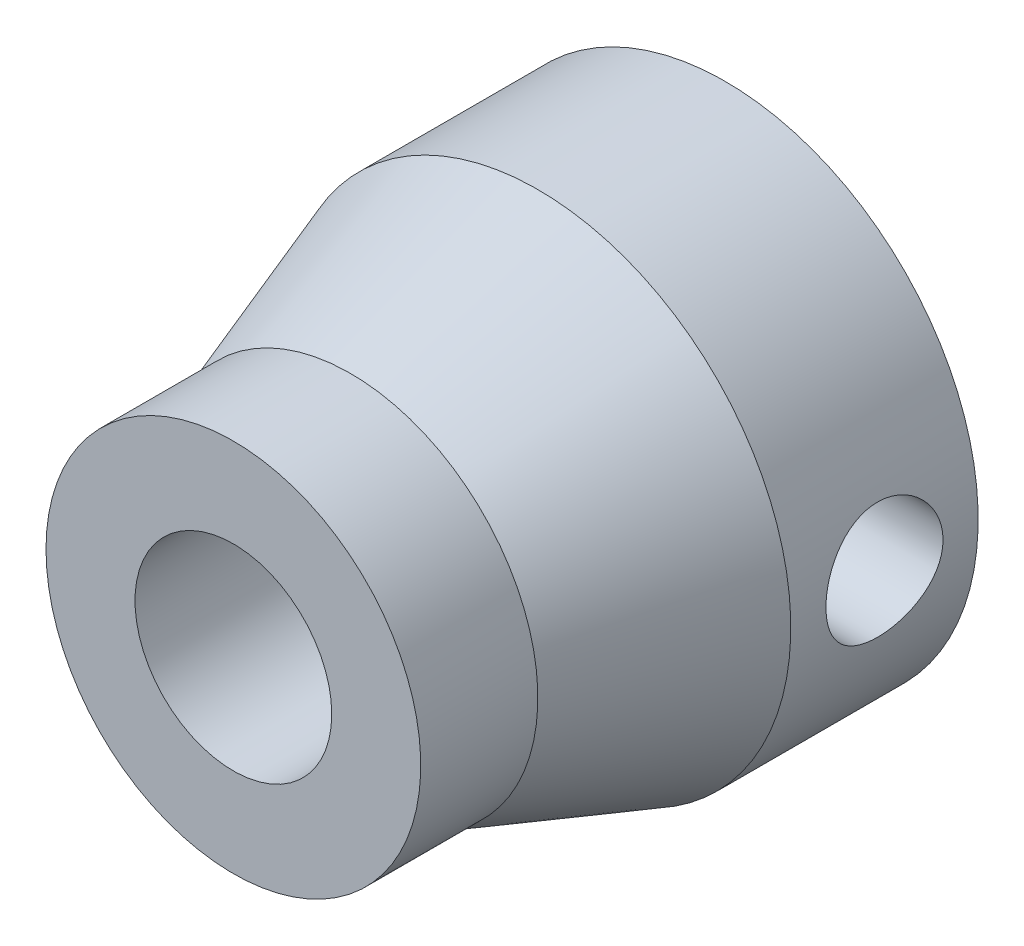
from build123d import *

# Parameters (mm, degrees)
CONNECTOR_M5X0_8_TAPPED_HOLE_D        = 4.2
SET_SCREW_1_M3X0_5_TAPPED_HOLE_REACH  = 16.767
SET_SCREW_1_M3X0_5_TAPPED_HOLE_BORE_R = 1.25


with BuildPart() as part:
    # Body Sketch → Body Revolve (revolve)
    with BuildSketch(Plane(origin=(0, 0, 0), x_dir=(-1, 0, 0), z_dir=(0, 1, 0))):
        Polygon((1, 10.5), (4, 10.5), (4, 8), (5.4, 4), (5.4, 0), (2.5, 0), (2.5, 5), (1, 5), align=None)
    revolve(axis=Axis((0, 0, 0), (0, 0, 1)))

    # Connector M5x0.8 Tapped Hole (through all)
    with Locations(Plane.XY.offset(10.5)):
        with Locations((0, 0)):
            Hole(CONNECTOR_M5X0_8_TAPPED_HOLE_D / 2)

    # Set Screw 1 M3x0.5 Tapped Hole bore (on position points) → Set Screw 1 M3x0.5 Tapped Hole (cut, up to next)
    with BuildSketch(Plane(origin=(5.4, 0, 2), x_dir=(0, 1, 0), z_dir=(1, 0, 0)), mode=Mode.PRIVATE) as set_screw_1_m3x0_5_tapped_hole_sk1:
        Circle(SET_SCREW_1_M3X0_5_TAPPED_HOLE_BORE_R)
    set_screw_1_m3x0_5_tapped_hole_tool1 = extrude(set_screw_1_m3x0_5_tapped_hole_sk1.sketch, amount=-SET_SCREW_1_M3X0_5_TAPPED_HOLE_REACH, mode=Mode.PRIVATE) & part.part
    add(set_screw_1_m3x0_5_tapped_hole_tool1.solids().sort_by_distance((5.4, 0, 2))[0], mode=Mode.SUBTRACT)


solid = part.part
